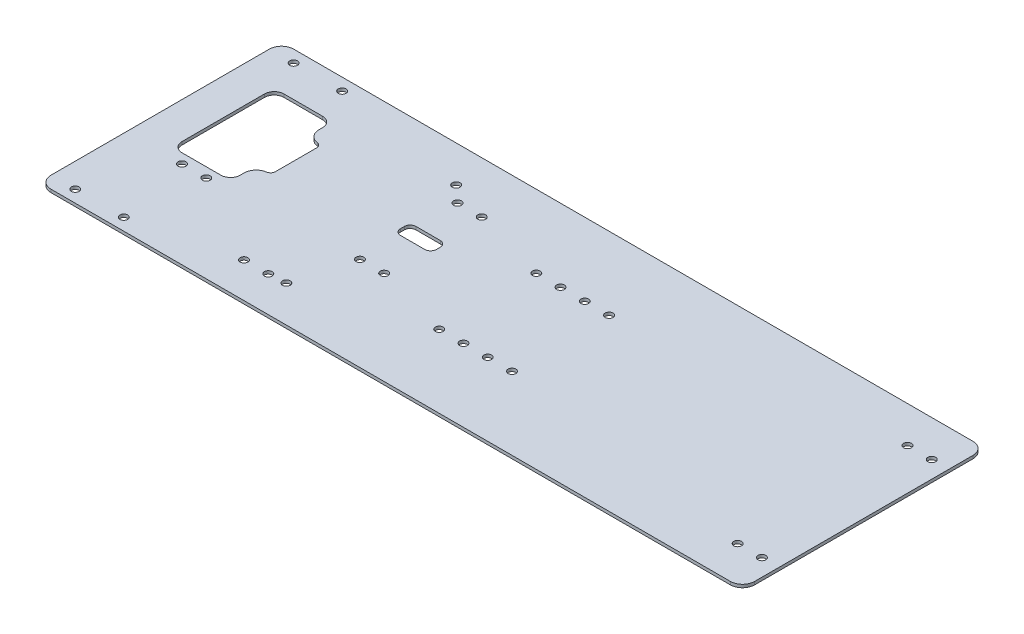
from build123d import *

# Parameters (mm, degrees)
SKETCH1_W               = 368.3
SKETCH1_H               = 127
SKETCH1_R               = 2.032
BOSS_EXTRUDE1_DEPTH     = 1.5875
FILLET1_R               = 5.08
FILLET3_R               = 6.35
FILLET4_R               = 2.54
FILLET5_R               = 6.35
SKETCH3_R               = 2.032
CUT_EXTRUDE5_DEPTH      = 195.797311855
CUT_EXTRUDE6_DEPTH      = 195.797311855
CUT_EXTRUDE6_DEPTH_BACK = 195.797311855
SKETCH4_R               = 2.032
CUT_EXTRUDE7_DEPTH      = 195.797311855
CUT_EXTRUDE7_DEPTH_BACK = 195.797311855


with BuildPart() as part:
    # Sketch1 → Boss-Extrude1 (new body)
    with BuildSketch(Plane(origin=(0, 0, 0), x_dir=(1, 0, 0), z_dir=(0, 1, 0))):
        Rectangle(SKETCH1_W, SKETCH1_H)
        with Locations((-171.45, -57.15)):
            Circle(SKETCH1_R, mode=Mode.SUBTRACT)
        with Locations((-146.05, -57.15)):
            Circle(SKETCH1_R, mode=Mode.SUBTRACT)
        with Locations((-95.25, -45.0215)):
            Circle(SKETCH1_R, mode=Mode.SUBTRACT)
        with Locations((-82.55, -45.0215)):
            Circle(SKETCH1_R, mode=Mode.SUBTRACT)
        with Locations((-154.94, -17.78)):
            Circle(SKETCH1_R, mode=Mode.SUBTRACT)
        with Locations((-142.24, -17.78)):
            Circle(SKETCH1_R, mode=Mode.SUBTRACT)
        Polygon((-134.62, -12.7), (-165.1, -12.7), (-165.1, 40.64), (-134.62, 40.64), (-134.62, 27.305), (-127, 27.305), (-127, 0.635), (-134.62, 0.635), align=None, mode=Mode.SUBTRACT)
        with Locations((-171.45, 57.15)):
            Circle(SKETCH1_R, mode=Mode.SUBTRACT)
        with Locations((-146.05, 57.15)):
            Circle(SKETCH1_R, mode=Mode.SUBTRACT)
    extrude(amount=BOSS_EXTRUDE1_DEPTH)

    # Fillet1
    fillet1_edges = [part.edges().sort_by_distance(p)[0] for p in [
        (-134.62, 0.79375, 12.7),
        (-165.1, 0.79375, 12.7),
        (-165.1, 0.79375, -40.64),
        (-134.62, 0.79375, -40.64),
    ]]
    fillet(fillet1_edges, radius=FILLET1_R)

    # Fillet3
    fillet3_edges = [part.edges().sort_by_distance(p)[0] for p in [
        (184.15, 0.79375, 63.5),
        (184.15, 0.79375, -63.5),
        (-184.15, 0.79375, 63.5),
        (-184.15, 0.79375, -63.5),
    ]]
    fillet(fillet3_edges, radius=FILLET3_R)

    # Fillet4
    fillet4_edges = [part.edges().sort_by_distance(p)[0] for p in [
        (-127, 0.79375, -0.635),
        (-127, 0.79375, -27.305),
    ]]
    fillet(fillet4_edges, radius=FILLET4_R)

    # Fillet5
    fillet5_edges = [part.edges().sort_by_distance(p)[0] for p in [
        (-134.62, 0.79375, -0.635),
        (-134.62, 0.79375, -27.305),
    ]]
    fillet(fillet5_edges, radius=FILLET5_R)

    # Sketch3 → Cut-Extrude5 (cut, through all)
    with BuildSketch(Plane(origin=(0, 1.5875, 0), x_dir=(1, 0, 0), z_dir=(0, 1, 0))):
        with Locations((-12.7, -25.4)):
            Circle(SKETCH3_R)
        with Locations((0, -25.4)):
            Circle(SKETCH3_R)
        with Locations((12.7, -25.4)):
            Circle(SKETCH3_R)
        with Locations((25.4, -25.4)):
            Circle(SKETCH3_R)
        with Locations((25.4, 25.4)):
            Circle(SKETCH3_R)
        with Locations((12.7, 25.4)):
            Circle(SKETCH3_R)
        with Locations((0, 25.4)):
            Circle(SKETCH3_R)
        with Locations((-12.7, 25.4)):
            Circle(SKETCH3_R)
        with Locations((162.56, -44.45)):
            Circle(SKETCH3_R)
        with Locations((162.56, 44.45)):
            Circle(SKETCH3_R)
        with Locations((-73.66, 44.45)):
            Circle(SKETCH3_R)
        with Locations((-73.66, -44.45)):
            Circle(SKETCH3_R)
        with Locations((175.26, 44.45)):
            Circle(SKETCH3_R)
        with Locations((175.26, -44.45)):
            Circle(SKETCH3_R)
    extrude(amount=-CUT_EXTRUDE5_DEPTH, mode=Mode.SUBTRACT)

    # Sketch4 → Cut-Extrude6 (cut, two sides: drawn at the far end of the back side and taken through both)
    with BuildSketch(Plane(origin=(0, 1.5875, 0), x_dir=(1, 0, 0), z_dir=(0, 1, 0)).offset(-CUT_EXTRUDE6_DEPTH_BACK)):
        with Locations((-65.136533, 36.598997136)):
            Circle(SKETCH4_R)
        with Locations((-52.436533, 36.598997136)):
            Circle(SKETCH4_R)
        with Locations((-65.136533, -14.463384864)):
            Circle(SKETCH4_R)
        with Locations((-52.436533, -14.463384864)):
            Circle(SKETCH4_R)
    extrude(amount=CUT_EXTRUDE6_DEPTH + CUT_EXTRUDE6_DEPTH_BACK, mode=Mode.SUBTRACT)

    # Sketch5 → Cut-Extrude7 (cut, two sides: drawn at the far end of the back side and taken through both)
    with BuildSketch(Plane(origin=(0, 1.5875, 0), x_dir=(1, 0, 0), z_dir=(0, 1, 0)).offset(-CUT_EXTRUDE7_DEPTH_BACK)):
        with BuildLine():
            ThreePointArc((-68.445, 10.067839136), (-67.545817818, 7.897021318), (-65.375, 6.997839136))
            Line((-65.375, 6.997839136), (-52.674614886, 6.997839253))
            ThreePointArc((-52.674614886, 6.997839253), (-50.530226494, 7.872352043), (-49.606927824, 9.996191435))
            Line((-49.606927824, 9.996191435), (-49.606927824, 12.08059101))
            ThreePointArc((-49.606927824, 12.08059101), (-50.509685219, 14.242253685), (-52.674329248, 15.137838782))
            Line((-52.674329248, 15.137838782), (-65.375, 15.137839136))
            ThreePointArc((-65.375, 15.137839136), (-67.545817818, 14.238656954), (-68.445, 12.067839136))
            Line((-68.445, 12.067839136), (-68.445, 10.067839136))
        make_face()
    extrude(amount=CUT_EXTRUDE7_DEPTH + CUT_EXTRUDE7_DEPTH_BACK, mode=Mode.SUBTRACT)


solid = part.part
